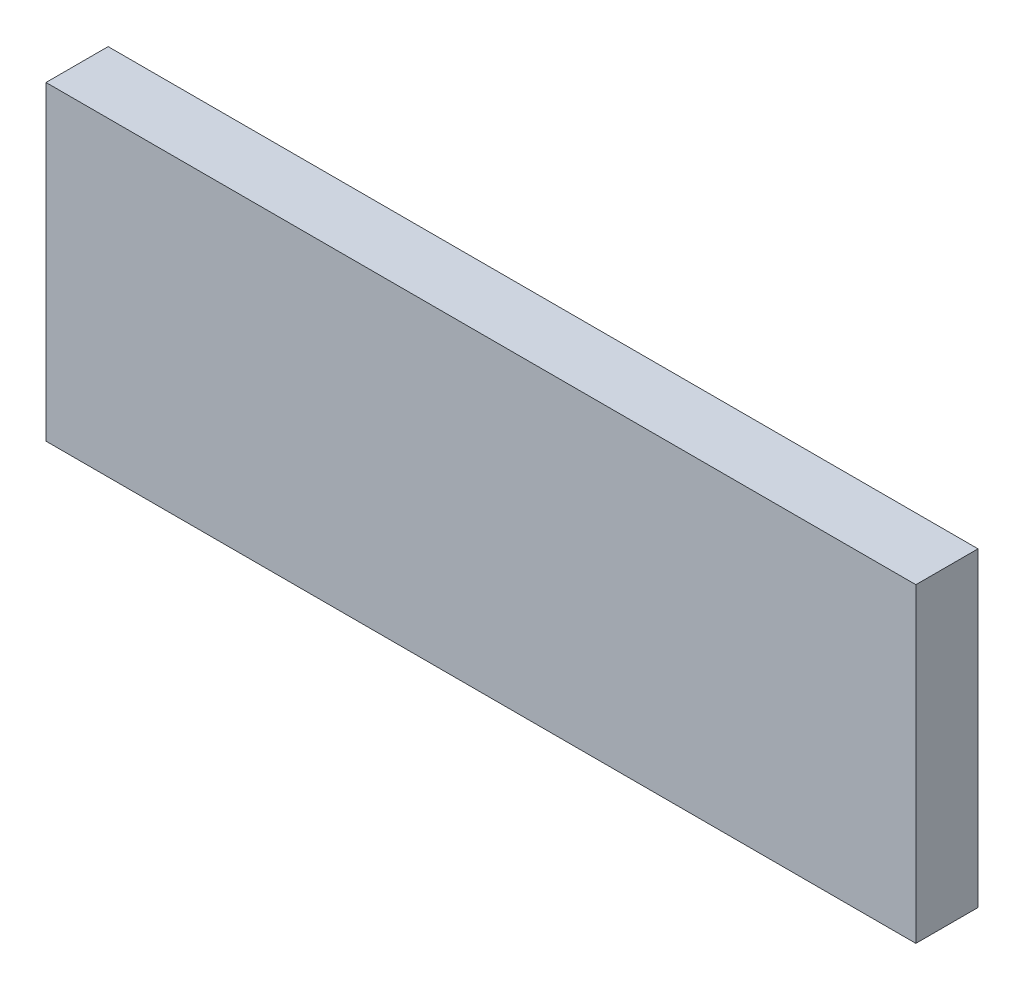
from build123d import *

# Parameters (mm, degrees)
SKETCH_1_W      = 280
SKETCH_1_H      = 20
EXTRUDE_1_DEPTH = 100


with BuildPart() as part:
    # 草图1 → 凸台-拉伸1 (new body)
    with BuildSketch(Plane(origin=(0, 0, 0), x_dir=(1, 0, 0), z_dir=(0, 1, 0))):
        with Locations((140, -10)):
            Rectangle(SKETCH_1_W, SKETCH_1_H)
    extrude(amount=EXTRUDE_1_DEPTH)


solid = part.part
